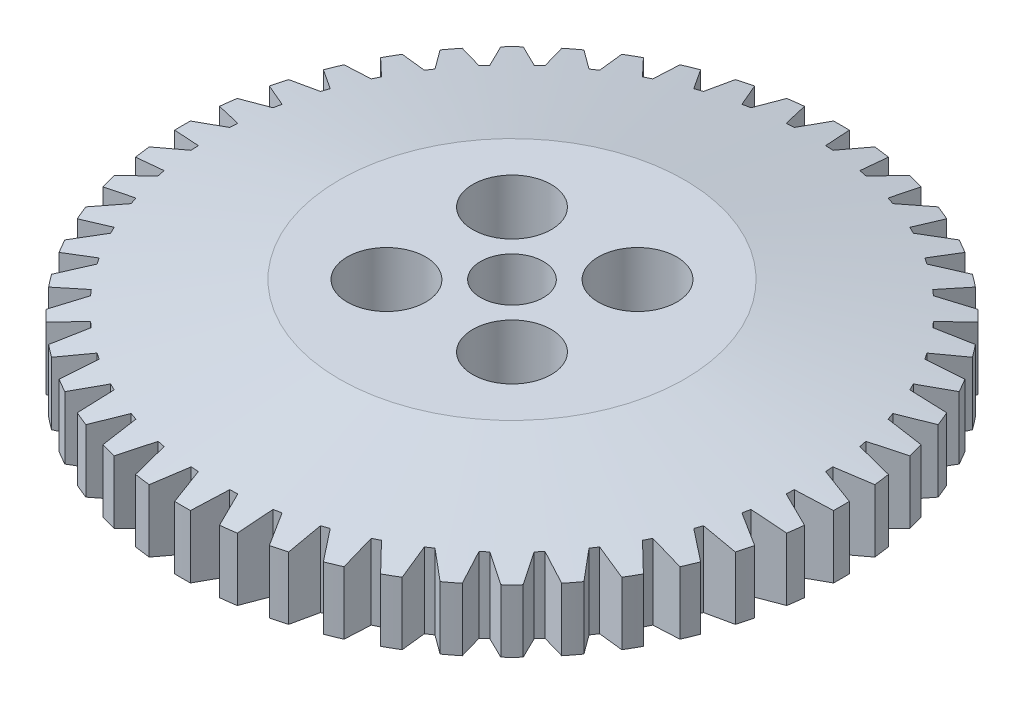
from build123d import *

# Parameters (mm, degrees)
SKETCH1_R           = 21
SKETCH1_R_2         = 2
SKETCH1_R_3         = 2.5
BOSS_EXTRUDE1_DEPTH = 8
CHAMFER1_SIZE       = 2
CHAMFER1_SIZE2      = 10
CUT_EXTRUDE3_REACH  = 32.757
SKETCH3_R           = 24.544514014


with BuildPart() as part:
    # Sketch1 → Boss-Extrude1 (new body)
    with BuildSketch(Plane(origin=(0, 0, 0), x_dir=(1, 0, 0), z_dir=(0, 1, 0))):
        with Locations(Location((0, 0, 0), (0, 0, 270))):
            Circle(SKETCH1_R)
        with Locations(Location((0, 0, 0), (0, 0, 270))):
            Circle(SKETCH1_R_2, mode=Mode.SUBTRACT)
        with Locations(Location((-4, 4, 0), (0, 0, 270))):
            Circle(SKETCH1_R_3, mode=Mode.SUBTRACT)
        with Locations(Location((4, 4, 0), (0, 0, 270))):
            Circle(SKETCH1_R_3, mode=Mode.SUBTRACT)
        with Locations(Location((4, -4, 0), (0, 0, 270))):
            Circle(SKETCH1_R_3, mode=Mode.SUBTRACT)
        with Locations(Location((-4, -4, 0), (0, 0, 270))):
            Circle(SKETCH1_R_3, mode=Mode.SUBTRACT)
    extrude(amount=BOSS_EXTRUDE1_DEPTH)

    # Chamfer1
    chamfer1_edges = [part.edges().sort_by_distance(p)[0] for p in [
        (0, 0, -21),
        (0, 8, -21),
    ]]
    chamfer1_side = [part.faces().sort_by_distance(p)[0] for p in [
        (0, 4, -21),
    ]]
    chamfer(chamfer1_edges, length=CHAMFER1_SIZE, length2=CHAMFER1_SIZE2, reference=chamfer1_side[0])

    # Cut-Extrude3: up to this face of the body (flat: up to its plane)
    cut_extrude3_end = Plane(part.part.faces().sort_by_distance((0, 8, -10.688873016))[0])
    # Sketch3 → Cut-Extrude3 (cut, up to the picked face)
    with BuildSketch(Plane(origin=(0, 0, 0), x_dir=(1, 0, 0), z_dir=(0, 1, 0)), mode=Mode.PRIVATE) as cut_extrude3_sk1:
        Circle(SKETCH3_R)
        with BuildLine():
            Line((-0.499964624, 21.010770279), (-1, 18.990407069))
            ThreePointArc((-1, 18.990407069), (-1.24375286, 18.976001672), (-1.487300662, 18.958467696))
            Line((-1.487300662, 18.958467696), (-2.246768483, 20.896278705))
            Line((-2.246768483, 20.896278705), (-3.238143198, 20.765761748))
            Line((-3.238143198, 20.765761748), (-3.470190385, 18.697415312))
            ThreePointArc((-3.470190385, 18.697415312), (-3.709977624, 18.651317023), (-3.949153197, 18.602143685))
            Line((-3.949153197, 18.602143685), (-4.955058758, 20.424246009))
            Line((-4.955058758, 20.424246009), (-5.920916243, 20.165445276))
            Line((-5.920916243, 20.165445276), (-5.88100485, 18.084505595))
            ThreePointArc((-5.88100485, 18.084505595), (-6.112723642, 18.007503167), (-6.343434627, 17.927531837))
            Line((-6.343434627, 17.927531837), (-7.578566604, 19.602748802))
            Line((-7.578566604, 19.602748802), (-8.50238077, 19.220092445))
            Line((-8.50238077, 19.220092445), (-8.191193692, 17.162164973))
            ThreePointArc((-8.191193692, 17.162164973), (-8.410879263, 17.055575941), (-8.629178131, 16.94617495))
            Line((-8.629178131, 16.94617495), (-10.072403074, 18.445843127))
            Line((-10.072403074, 18.445843127), (-10.938367205, 17.945878503))
            Line((-10.938367205, 17.945878503), (-10.361228938, 15.94617495))
            ThreePointArc((-10.361228938, 15.94617495), (-10.565122409, 15.811823081), (-10.767274004, 15.674864311))
            Line((-10.767274004, 15.674864311), (-12.393897935, 16.973323962))
            Line((-12.393897935, 16.973323962), (-13.187195144, 16.364605604))
            Line((-13.187195144, 16.364605604), (-12.353980685, 14.457341453))
            ThreePointArc((-12.353980685, 14.457341453), (-12.538593381, 14.297525544), (-12.721138835, 14.135352397))
            Line((-12.721138835, 14.135352397), (-14.503329766, 15.210386518))
            Line((-14.503329766, 15.210386518), (-15.210386518, 14.503329766))
            Line((-15.210386518, 14.503329766), (-14.135352397, 12.721138835))
            ThreePointArc((-14.135352397, 12.721138835), (-14.297525544, 12.538593381), (-14.457341453, 12.353980685))
            Line((-14.457341453, 12.353980685), (-16.364605604, 13.187195144))
            Line((-16.364605604, 13.187195144), (-16.973323962, 12.393897935))
            Line((-16.973323962, 12.393897935), (-15.674864311, 10.767274004))
            ThreePointArc((-15.674864311, 10.767274004), (-15.811823081, 10.565122409), (-15.94617495, 10.361228938))
            Line((-15.94617495, 10.361228938), (-17.945878503, 10.938367205))
            Line((-17.945878503, 10.938367205), (-18.445843127, 10.072403074))
            Line((-18.445843127, 10.072403074), (-16.94617495, 8.629178131))
            ThreePointArc((-16.94617495, 8.629178131), (-17.055575941, 8.410879263), (-17.162164973, 8.191193692))
            Line((-17.162164973, 8.191193692), (-19.220092445, 8.50238077))
            Line((-19.220092445, 8.50238077), (-19.602748802, 7.578566604))
            Line((-19.602748802, 7.578566604), (-17.927531837, 6.343434627))
            ThreePointArc((-17.927531837, 6.343434627), (-18.007503167, 6.112723642), (-18.084505595, 5.88100485))
            Line((-18.084505595, 5.88100485), (-20.165445276, 5.920916243))
            Line((-20.165445276, 5.920916243), (-20.424246009, 4.955058758))
            Line((-20.424246009, 4.955058758), (-18.602143685, 3.949153197))
            ThreePointArc((-18.602143685, 3.949153197), (-18.651317023, 3.709977624), (-18.697415312, 3.470190385))
            Line((-18.697415312, 3.470190385), (-20.765761748, 3.238143198))
            Line((-20.765761748, 3.238143198), (-20.896278705, 2.246768483))
            Line((-20.896278705, 2.246768483), (-18.958467696, 1.487300662))
            ThreePointArc((-18.958467696, 1.487300662), (-18.976001672, 1.24375286), (-18.990407069, 1))
            Line((-18.990407069, 1), (-21.010770279, 0.499964624))
            Line((-21.010770279, 0.499964624), (-21.010770279, -0.499964624))
            Line((-21.010770279, -0.499964624), (-18.990407069, -1))
            ThreePointArc((-18.990407069, -1), (-18.976001672, -1.24375286), (-18.958467696, -1.487300662))
            Line((-18.958467696, -1.487300662), (-20.896278705, -2.246768483))
            Line((-20.896278705, -2.246768483), (-20.765761748, -3.238143198))
            Line((-20.765761748, -3.238143198), (-18.697415312, -3.470190385))
            ThreePointArc((-18.697415312, -3.470190385), (-18.651317023, -3.709977624), (-18.602143685, -3.949153197))
            Line((-18.602143685, -3.949153197), (-20.424246009, -4.955058758))
            Line((-20.424246009, -4.955058758), (-20.165445276, -5.920916243))
            Line((-20.165445276, -5.920916243), (-18.084505595, -5.88100485))
            ThreePointArc((-18.084505595, -5.88100485), (-18.007503167, -6.112723642), (-17.927531837, -6.343434627))
            Line((-17.927531837, -6.343434627), (-19.602748802, -7.578566604))
            Line((-19.602748802, -7.578566604), (-19.220092445, -8.50238077))
            Line((-19.220092445, -8.50238077), (-17.162164973, -8.191193692))
            ThreePointArc((-17.162164973, -8.191193692), (-17.055575941, -8.410879263), (-16.94617495, -8.629178131))
            Line((-16.94617495, -8.629178131), (-18.445843127, -10.072403074))
            Line((-18.445843127, -10.072403074), (-17.945878503, -10.938367205))
            Line((-17.945878503, -10.938367205), (-15.94617495, -10.361228938))
            ThreePointArc((-15.94617495, -10.361228938), (-15.811823081, -10.565122409), (-15.674864311, -10.767274004))
            Line((-15.674864311, -10.767274004), (-16.973323962, -12.393897935))
            Line((-16.973323962, -12.393897935), (-16.364605604, -13.187195144))
            Line((-16.364605604, -13.187195144), (-14.457341453, -12.353980685))
            ThreePointArc((-14.457341453, -12.353980685), (-14.297525544, -12.538593381), (-14.135352397, -12.721138835))
            Line((-14.135352397, -12.721138835), (-15.210386518, -14.503329766))
            Line((-15.210386518, -14.503329766), (-14.503329766, -15.210386518))
            Line((-14.503329766, -15.210386518), (-12.721138835, -14.135352397))
            ThreePointArc((-12.721138835, -14.135352397), (-12.538593381, -14.297525544), (-12.353980685, -14.457341453))
            Line((-12.353980685, -14.457341453), (-13.187195144, -16.364605604))
            Line((-13.187195144, -16.364605604), (-12.393897935, -16.973323962))
            Line((-12.393897935, -16.973323962), (-10.767274004, -15.674864311))
            ThreePointArc((-10.767274004, -15.674864311), (-10.565122409, -15.811823081), (-10.361228938, -15.94617495))
            Line((-10.361228938, -15.94617495), (-10.938367205, -17.945878503))
            Line((-10.938367205, -17.945878503), (-10.072403074, -18.445843127))
            Line((-10.072403074, -18.445843127), (-8.629178131, -16.94617495))
            ThreePointArc((-8.629178131, -16.94617495), (-8.410879263, -17.055575941), (-8.191193692, -17.162164973))
            Line((-8.191193692, -17.162164973), (-8.50238077, -19.220092445))
            Line((-8.50238077, -19.220092445), (-7.578566604, -19.602748802))
            Line((-7.578566604, -19.602748802), (-6.343434627, -17.927531837))
            ThreePointArc((-6.343434627, -17.927531837), (-6.112723642, -18.007503167), (-5.88100485, -18.084505595))
            Line((-5.88100485, -18.084505595), (-5.920916243, -20.165445276))
            Line((-5.920916243, -20.165445276), (-4.955058758, -20.424246009))
            Line((-4.955058758, -20.424246009), (-3.949153197, -18.602143685))
            ThreePointArc((-3.949153197, -18.602143685), (-3.709977624, -18.651317023), (-3.470190385, -18.697415312))
            Line((-3.470190385, -18.697415312), (-3.238143198, -20.765761748))
            Line((-3.238143198, -20.765761748), (-2.246768483, -20.896278705))
            Line((-2.246768483, -20.896278705), (-1.487300662, -18.958467696))
            ThreePointArc((-1.487300662, -18.958467696), (-1.24375286, -18.976001672), (-1, -18.990407069))
            Line((-1, -18.990407069), (-0.499964624, -21.010770279))
            Line((-0.499964624, -21.010770279), (0.499964624, -21.010770279))
            Line((0.499964624, -21.010770279), (1, -18.990407069))
            ThreePointArc((1, -18.990407069), (1.24375286, -18.976001672), (1.487300662, -18.958467696))
            Line((1.487300662, -18.958467696), (2.246768483, -20.896278705))
            Line((2.246768483, -20.896278705), (3.238143198, -20.765761748))
            Line((3.238143198, -20.765761748), (3.470190385, -18.697415312))
            ThreePointArc((3.470190385, -18.697415312), (3.709977624, -18.651317023), (3.949153197, -18.602143685))
            Line((3.949153197, -18.602143685), (4.955058758, -20.424246009))
            Line((4.955058758, -20.424246009), (5.920916243, -20.165445276))
            Line((5.920916243, -20.165445276), (5.88100485, -18.084505595))
            ThreePointArc((5.88100485, -18.084505595), (6.112723642, -18.007503167), (6.343434627, -17.927531837))
            Line((6.343434627, -17.927531837), (7.578566604, -19.602748802))
            Line((7.578566604, -19.602748802), (8.50238077, -19.220092445))
            Line((8.50238077, -19.220092445), (8.191193692, -17.162164973))
            ThreePointArc((8.191193692, -17.162164973), (8.410879263, -17.055575941), (8.629178131, -16.94617495))
            Line((8.629178131, -16.94617495), (10.072403074, -18.445843127))
            Line((10.072403074, -18.445843127), (10.938367205, -17.945878503))
            Line((10.938367205, -17.945878503), (10.361228938, -15.94617495))
            ThreePointArc((10.361228938, -15.94617495), (10.565122409, -15.811823081), (10.767274004, -15.674864311))
            Line((10.767274004, -15.674864311), (12.393897935, -16.973323962))
            Line((12.393897935, -16.973323962), (13.187195144, -16.364605604))
            Line((13.187195144, -16.364605604), (12.353980685, -14.457341453))
            ThreePointArc((12.353980685, -14.457341453), (12.538593381, -14.297525544), (12.721138835, -14.135352397))
            Line((12.721138835, -14.135352397), (14.503329766, -15.210386518))
            Line((14.503329766, -15.210386518), (15.210386518, -14.503329766))
            Line((15.210386518, -14.503329766), (14.135352397, -12.721138835))
            ThreePointArc((14.135352397, -12.721138835), (14.297525544, -12.538593381), (14.457341453, -12.353980685))
            Line((14.457341453, -12.353980685), (16.364605604, -13.187195144))
            Line((16.364605604, -13.187195144), (16.973323962, -12.393897935))
            Line((16.973323962, -12.393897935), (15.674864311, -10.767274004))
            ThreePointArc((15.674864311, -10.767274004), (15.811823081, -10.565122409), (15.94617495, -10.361228938))
            Line((15.94617495, -10.361228938), (17.945878503, -10.938367205))
            Line((17.945878503, -10.938367205), (18.445843127, -10.072403074))
            Line((18.445843127, -10.072403074), (16.94617495, -8.629178131))
            ThreePointArc((16.94617495, -8.629178131), (17.055575941, -8.410879263), (17.162164973, -8.191193692))
            Line((17.162164973, -8.191193692), (19.220092445, -8.50238077))
            Line((19.220092445, -8.50238077), (19.602748802, -7.578566604))
            Line((19.602748802, -7.578566604), (17.927531837, -6.343434627))
            ThreePointArc((17.927531837, -6.343434627), (18.007503167, -6.112723642), (18.084505595, -5.88100485))
            Line((18.084505595, -5.88100485), (20.165445276, -5.920916243))
            Line((20.165445276, -5.920916243), (20.424246009, -4.955058758))
            Line((20.424246009, -4.955058758), (18.602143685, -3.949153197))
            ThreePointArc((18.602143685, -3.949153197), (18.651317023, -3.709977624), (18.697415312, -3.470190385))
            Line((18.697415312, -3.470190385), (20.765761748, -3.238143198))
            Line((20.765761748, -3.238143198), (20.896278705, -2.246768483))
            Line((20.896278705, -2.246768483), (18.958467696, -1.487300662))
            ThreePointArc((18.958467696, -1.487300662), (18.976001672, -1.24375286), (18.990407069, -1))
            Line((18.990407069, -1), (21.010770279, -0.499964624))
            Line((21.010770279, -0.499964624), (21.010770279, 0.499964624))
            Line((21.010770279, 0.499964624), (18.990407069, 1))
            ThreePointArc((18.990407069, 1), (18.976001672, 1.24375286), (18.958467696, 1.487300662))
            Line((18.958467696, 1.487300662), (20.896278705, 2.246768483))
            Line((20.896278705, 2.246768483), (20.765761748, 3.238143198))
            Line((20.765761748, 3.238143198), (18.697415312, 3.470190385))
            ThreePointArc((18.697415312, 3.470190385), (18.651317023, 3.709977624), (18.602143685, 3.949153197))
            Line((18.602143685, 3.949153197), (20.424246009, 4.955058758))
            Line((20.424246009, 4.955058758), (20.165445276, 5.920916243))
            Line((20.165445276, 5.920916243), (18.084505595, 5.88100485))
            ThreePointArc((18.084505595, 5.88100485), (18.007503167, 6.112723642), (17.927531837, 6.343434627))
            Line((17.927531837, 6.343434627), (19.602748802, 7.578566604))
            Line((19.602748802, 7.578566604), (19.220092445, 8.50238077))
            Line((19.220092445, 8.50238077), (17.162164973, 8.191193692))
            ThreePointArc((17.162164973, 8.191193692), (17.055575941, 8.410879263), (16.94617495, 8.629178131))
            Line((16.94617495, 8.629178131), (18.445843127, 10.072403074))
            Line((18.445843127, 10.072403074), (17.945878503, 10.938367205))
            Line((17.945878503, 10.938367205), (15.94617495, 10.361228938))
            ThreePointArc((15.94617495, 10.361228938), (15.811823081, 10.565122409), (15.674864311, 10.767274004))
            Line((15.674864311, 10.767274004), (16.973323962, 12.393897935))
            Line((16.973323962, 12.393897935), (16.364605604, 13.187195144))
            Line((16.364605604, 13.187195144), (14.457341453, 12.353980685))
            ThreePointArc((14.457341453, 12.353980685), (14.297525544, 12.538593381), (14.135352397, 12.721138835))
            Line((14.135352397, 12.721138835), (15.210386518, 14.503329766))
            Line((15.210386518, 14.503329766), (14.503329766, 15.210386518))
            Line((14.503329766, 15.210386518), (12.721138835, 14.135352397))
            ThreePointArc((12.721138835, 14.135352397), (12.538593381, 14.297525544), (12.353980685, 14.457341453))
            Line((12.353980685, 14.457341453), (13.187195144, 16.364605604))
            Line((13.187195144, 16.364605604), (12.393897935, 16.973323962))
            Line((12.393897935, 16.973323962), (10.767274004, 15.674864311))
            ThreePointArc((10.767274004, 15.674864311), (10.565122409, 15.811823081), (10.361228938, 15.94617495))
            Line((10.361228938, 15.94617495), (10.938367205, 17.945878503))
            Line((10.938367205, 17.945878503), (10.072403074, 18.445843127))
            Line((10.072403074, 18.445843127), (8.629178131, 16.94617495))
            ThreePointArc((8.629178131, 16.94617495), (8.410879263, 17.055575941), (8.191193692, 17.162164973))
            Line((8.191193692, 17.162164973), (8.50238077, 19.220092445))
            Line((8.50238077, 19.220092445), (7.578566604, 19.602748802))
            Line((7.578566604, 19.602748802), (6.343434627, 17.927531837))
            ThreePointArc((6.343434627, 17.927531837), (6.112723642, 18.007503167), (5.88100485, 18.084505595))
            Line((5.88100485, 18.084505595), (5.920916243, 20.165445276))
            Line((5.920916243, 20.165445276), (4.955058758, 20.424246009))
            Line((4.955058758, 20.424246009), (3.949153197, 18.602143685))
            ThreePointArc((3.949153197, 18.602143685), (3.709977624, 18.651317023), (3.470190385, 18.697415312))
            Line((3.470190385, 18.697415312), (3.238143198, 20.765761748))
            Line((3.238143198, 20.765761748), (2.246768483, 20.896278705))
            Line((2.246768483, 20.896278705), (1.487300662, 18.958467696))
            ThreePointArc((1.487300662, 18.958467696), (1.24375286, 18.976001672), (1, 18.990407069))
            Line((1, 18.990407069), (0.499964624, 21.010770279))
            Line((0.499964624, 21.010770279), (-0.499964624, 21.010770279))
        make_face(mode=Mode.SUBTRACT)
    cut_extrude3_tool1 = split(extrude(cut_extrude3_sk1.sketch, amount=CUT_EXTRUDE3_REACH, mode=Mode.PRIVATE), bisect_by=cut_extrude3_end, keep=Keep.BOTH, mode=Mode.PRIVATE)
    add(cut_extrude3_tool1.solids().sort_by(Axis((-23.85029, 0, 0), (0, 1, 0)))[0], mode=Mode.SUBTRACT)


solid = part.part
